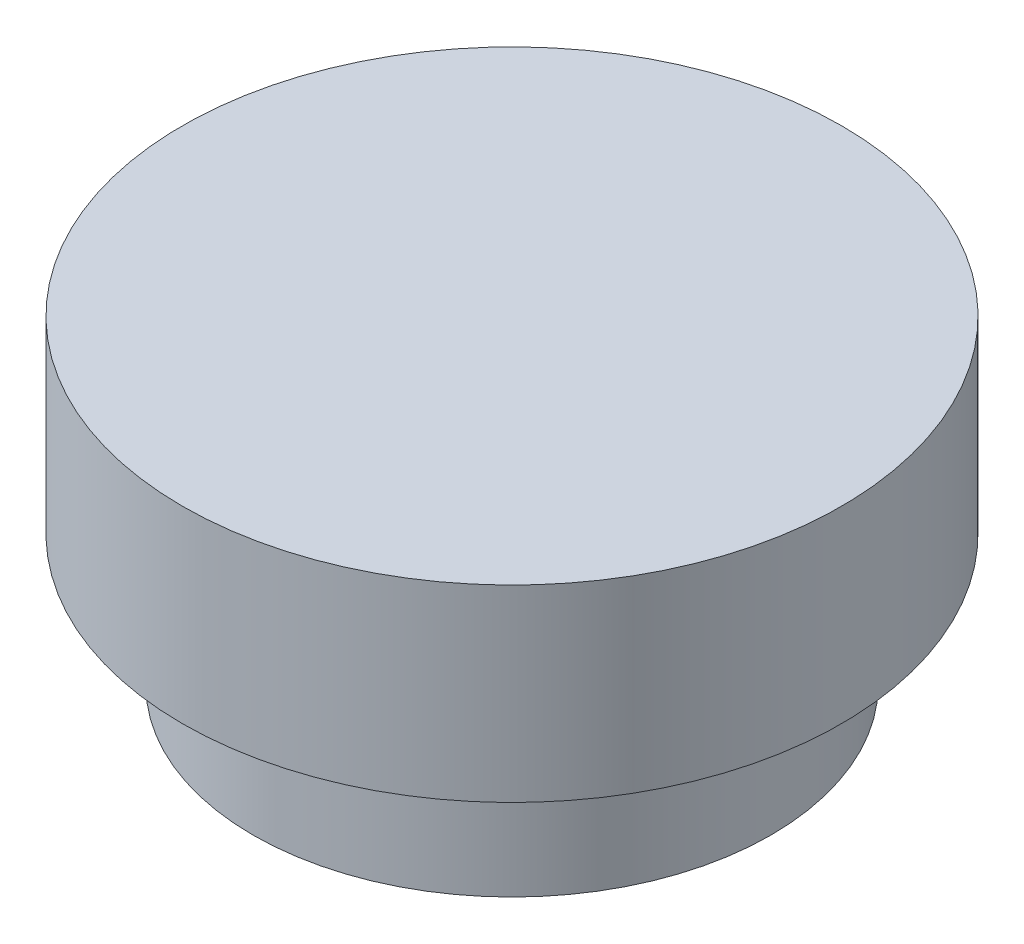
from build123d import *

# Parameters (mm, degrees)
SKETCH1_R           = 1.25
BOSS_EXTRUDE1_DEPTH = 2.5
SKETCH2_R           = 6.875
BOSS_EXTRUDE2_DEPTH = 3.5
SKETCH3_R           = 8.75
BOSS_EXTRUDE3_DEPTH = 5


with BuildPart() as part:
    # Sketch1 → Boss-Extrude1 (new body)
    with BuildSketch(Plane(origin=(0, 0, 0), x_dir=(1, 0, 0), z_dir=(0, 1, 0))):
        with Locations(Location((0, 0, 0), (0, 0, 270))):
            Circle(SKETCH1_R)
    extrude(amount=BOSS_EXTRUDE1_DEPTH)

    # Sketch2 → Boss-Extrude2 (add)
    with BuildSketch(Plane(origin=(0, 2.5, 0), x_dir=(1, 0, 0), z_dir=(0, 1, 0))):
        with Locations(Location((0, 0, 0), (0, 0, 270))):
            Circle(SKETCH2_R)
    extrude(amount=BOSS_EXTRUDE2_DEPTH)

    # Sketch3 → Boss-Extrude3 (add)
    with BuildSketch(Plane(origin=(0, 6, 0), x_dir=(1, 0, 0), z_dir=(0, 1, 0))):
        with Locations(Location((0, 0, 0), (0, 0, 270))):
            Circle(SKETCH3_R)
    extrude(amount=BOSS_EXTRUDE3_DEPTH)


solid = part.part
